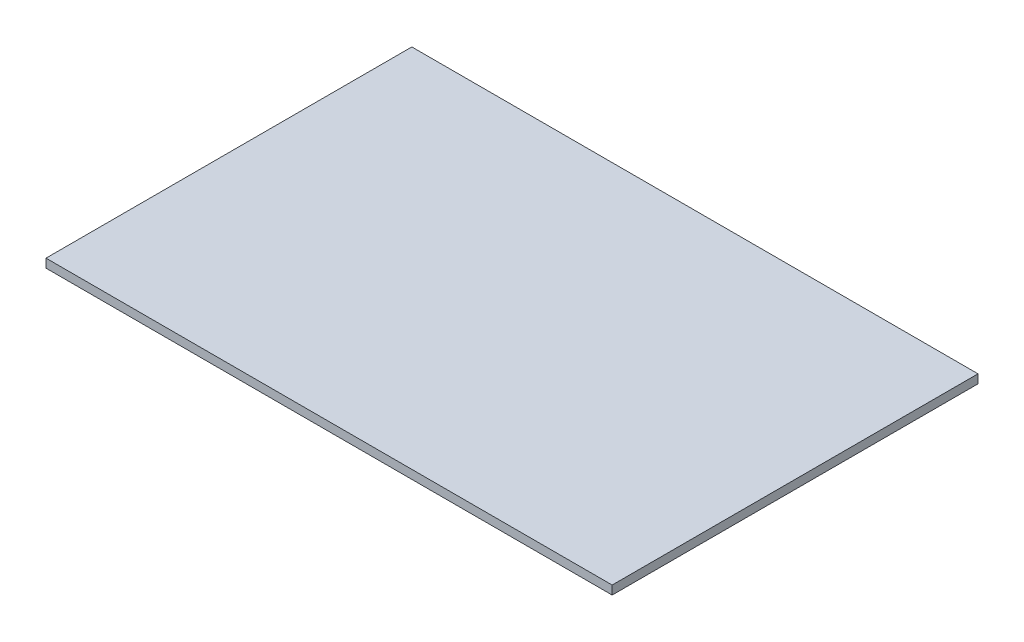
from build123d import *

# Parameters (mm, degrees)
CROQUIS2_W              = 195
CROQUIS2_H              = 3
SALIENTE_EXTRUIR2_DEPTH = 126


with BuildPart() as part:
    # Croquis2 → Saliente-Extruir2 (new body)
    with BuildSketch(Plane.XY):
        with Locations((0, 1.5)):
            Rectangle(CROQUIS2_W, CROQUIS2_H)
    extrude(amount=-SALIENTE_EXTRUIR2_DEPTH)


solid = part.part
